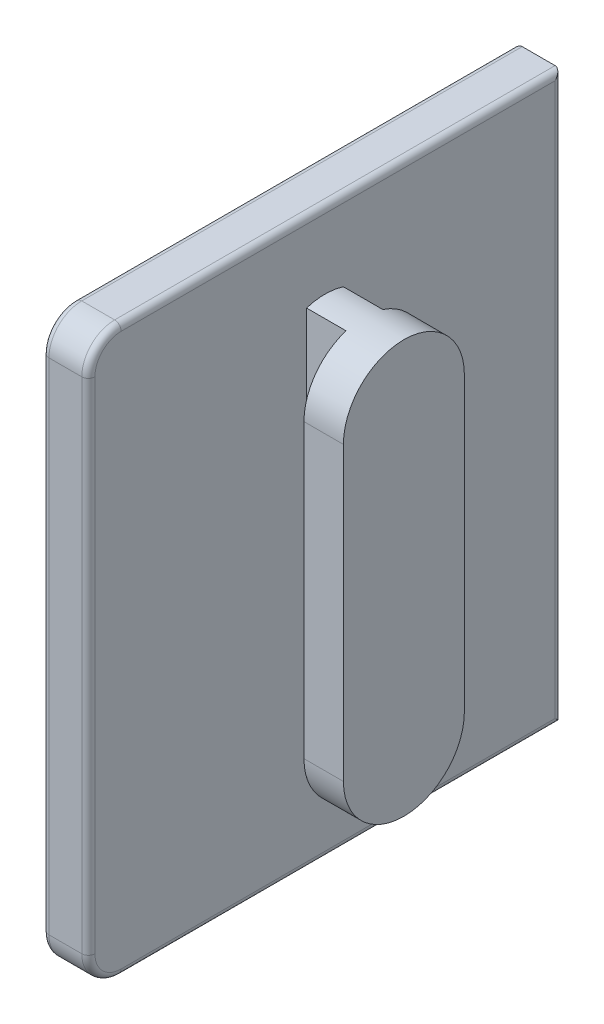
from build123d import *

# Parameters (mm, degrees)
SKICA1_W                = 36
SKICA1_H                = 43
P_IDAT_VYSUNUT_M1_DEPTH = 3.5
P_IDAT_VYSUNUT_M2_DEPTH = 3
P_IDAT_VYSUNUT_M3_DEPTH = 3
ZAOBLIT1_R              = 2.5
ZAOBLIT2_R              = 0.5


with BuildPart() as part:
    # Skica1 → Přidat vysunutím1 (new body)
    with BuildSketch(Plane(origin=(0, 0, 0), x_dir=(0, 0, -1), z_dir=(1, 0, 0))):
        Rectangle(SKICA1_W, SKICA1_H)
    extrude(amount=P_IDAT_VYSUNUT_M1_DEPTH)

    # Skica2 → Přidat vysunutím2 (add)
    with BuildSketch(Plane(origin=(3.5, 0, 0), x_dir=(0, 0, -1), z_dir=(1, 0, 0))):
        with BuildLine():
            Line((-1.4, 15.48178046), (-1.4, -15.48178046))
            ThreePointArc((-1.4, -15.48178046), (0, -15.7), (1.4, -15.48178046))
            Line((1.4, -15.48178046), (1.4, 15.48178046))
            ThreePointArc((1.4, 15.48178046), (0, 15.7), (-1.4, 15.48178046))
        make_face()
    extrude(amount=P_IDAT_VYSUNUT_M2_DEPTH)

    # Skica3 → Přidat vysunutím3 (add)
    with BuildSketch(Plane(origin=(6.5, 0, 0), x_dir=(0, 0, -1), z_dir=(1, 0, 0))):
        with BuildLine():
            Line((-4.6, -11.1), (-4.6, 11.1))
            ThreePointArc((-4.6, 11.1), (0, 15.7), (4.6, 11.1))
            Line((4.6, 11.1), (4.6, -11.1))
            ThreePointArc((4.6, -11.1), (0, -15.7), (-4.6, -11.1))
        make_face()
    extrude(amount=P_IDAT_VYSUNUT_M3_DEPTH)

    # Zaoblit1
    zaoblit1_edges = [part.edges().sort_by_distance(p)[0] for p in [
        (1.75, -21.5, 18),
        (1.75, 21.5, 18),
    ]]
    fillet(zaoblit1_edges, radius=ZAOBLIT1_R)

    # Zaoblit2
    zaoblit2_edges = [part.edges().sort_by_distance(p)[0] for p in [
        (3.5, 0, -18),
        (0, -21.5, -1.25),
        (3.5, -21.5, -1.25),
        (0, 0, 18),
        (0, 20.767766953, 17.267766953),
        (0, -20.767766953, 17.267766953),
        (3.5, 0, 18),
        (3.5, 20.767766953, 17.267766953),
        (3.5, -20.767766953, 17.267766953),
        (0, 21.5, -1.25),
        (0, 0, -18),
        (3.5, 21.5, -1.25),
    ]]
    fillet(zaoblit2_edges, radius=ZAOBLIT2_R)


solid = part.part
